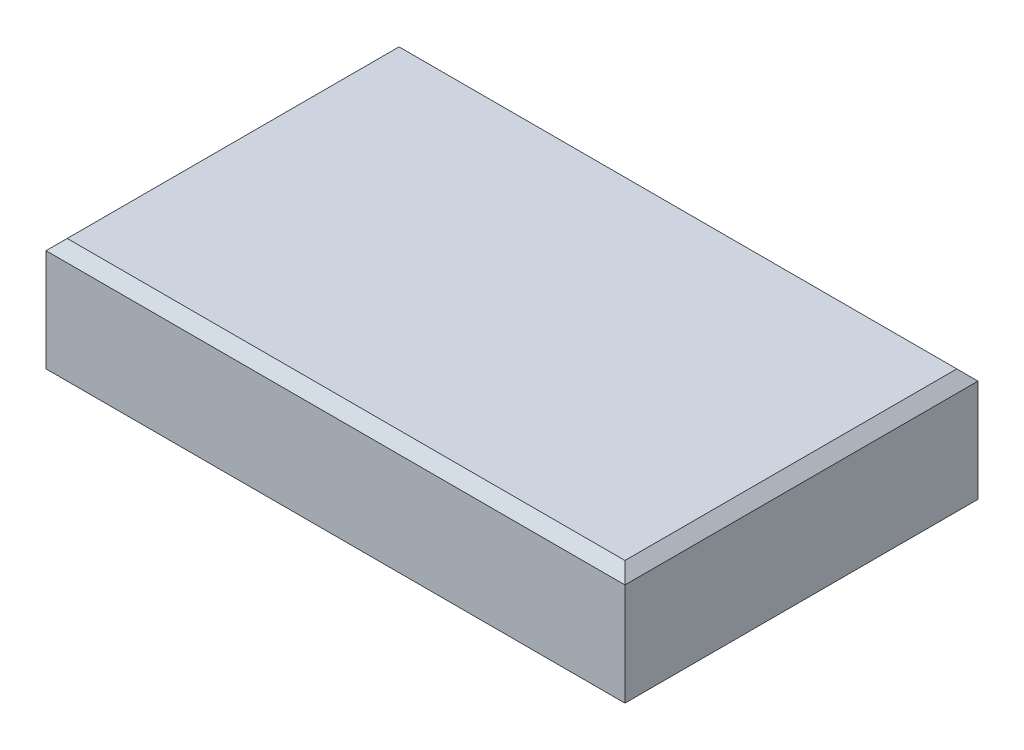
from build123d import *

# Parameters (mm, degrees)
SKETCH1_W           = 82
SKETCH1_H           = 50
BOSS_EXTRUDE1_DEPTH = 8
CHAMFER1_SIZE       = 1.5


with BuildPart() as part:
    # Sketch1 → Boss-Extrude1 (new, symmetric)
    with BuildSketch(Plane(origin=(0, 0, 0), x_dir=(1, 0, 0), z_dir=(0, 1, 0))):
        Rectangle(SKETCH1_W, SKETCH1_H)
    extrude(amount=BOSS_EXTRUDE1_DEPTH, both=True)

    # Chamfer1
    chamfer1_edges = [part.edges().sort_by_distance(p)[0] for p in [
        (-41, 8, 0),
        (0, 8, 25),
        (41, 8, 0),
        (0, 8, -25),
    ]]
    chamfer(chamfer1_edges, length=CHAMFER1_SIZE)


solid = part.part
